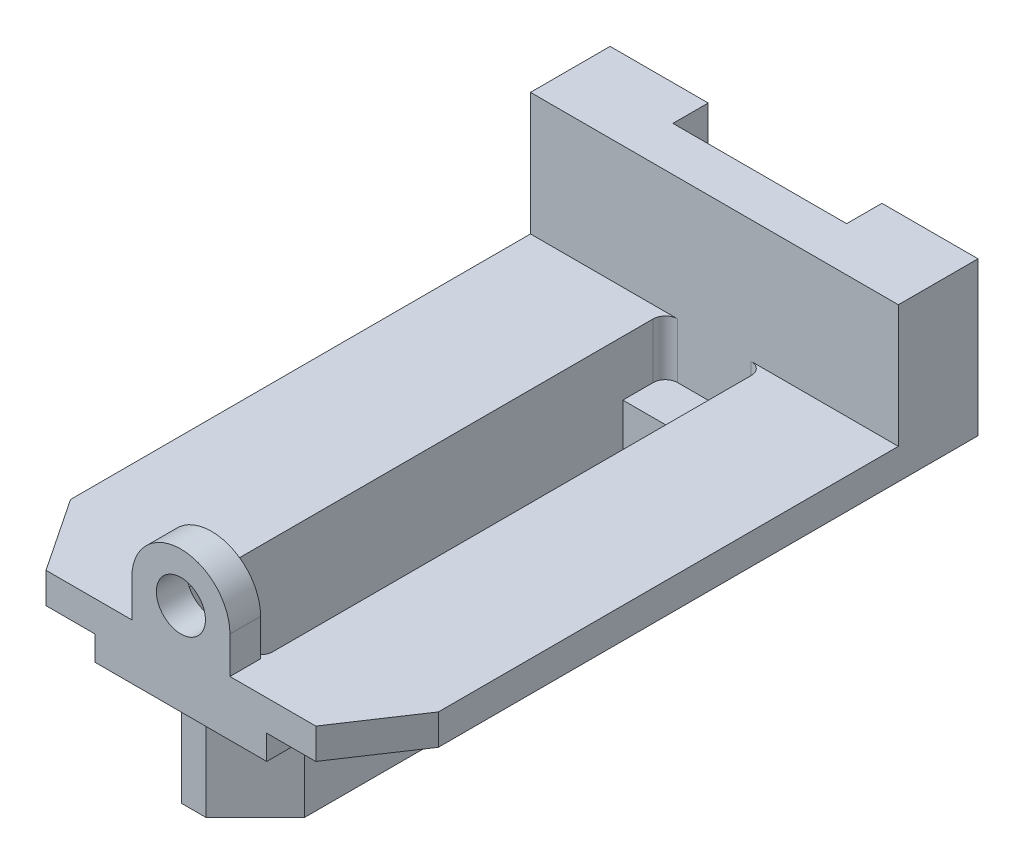
from build123d import *

# Parameters (mm, degrees)
BOSS_EXTRUDE1_DEPTH = 100
SKETCH2_R           = 4
BOSS_EXTRUDE2_DEPTH = 5
CUT_EXTRUDE1_DEPTH  = 111.145358504
BOSS_EXTRUDE3_DEPTH = 20
SKETCH6_W           = 16
SKETCH6_H           = 82.013760225
CUT_EXTRUDE2_DEPTH  = 20
FILLET1_R           = 2
SKETCH7_W           = 20
SKETCH7_H           = 90.042878707
SKETCH7_W_2         = 16
SKETCH7_H_2         = 66.692206804
BOSS_EXTRUDE4_DEPTH = 15
CHAMFER1_SIZE       = 8


with BuildPart() as part:
    # Sketch1 → Boss-Extrude1 (new body)
    with BuildSketch(Plane.XY):
        Polygon((28, 4), (44, 4), (44, 9), (-16, 9), (-16, 4), (0, 4), (0, 0), (28, 0), align=None)
    extrude(amount=BOSS_EXTRUDE1_DEPTH)

    # Sketch2 → Boss-Extrude2 (add)
    with BuildSketch(Plane.XY.offset(100)):
        with BuildLine():
            Line((6, 15), (6, 0))
            Line((6, 0), (22, 0))
            Line((22, 0), (22, 15))
            ThreePointArc((22, 15), (14, 23), (6, 15))
        make_face()
        with Locations((14, 15)):
            Circle(SKETCH2_R, mode=Mode.SUBTRACT)
    extrude(amount=-BOSS_EXTRUDE2_DEPTH)

    # Sketch3 → Cut-Extrude1 (cut, through all)
    with BuildSketch(Plane(origin=(0, 9, 0), x_dir=(1, 0, 0), z_dir=(0, 1, 0))):
        Polygon((36, -100), (44, -88), (44, -100), align=None)
        Polygon((-8, -100), (-16, -100), (-16, -88), align=None)
    extrude(amount=-CUT_EXTRUDE1_DEPTH, mode=Mode.SUBTRACT)

    # Sketch5 → Boss-Extrude3 (add)
    with BuildSketch(Plane(origin=(0, 9, 0), x_dir=(1, 0, 0), z_dir=(0, 1, 0))):
        Polygon((-16, 0), (0, 0), (0, -5.756429966), (28.329099736, -5.756429966), (28.329099736, 0), (44, 0), (44, -12.986239775), (-16, -12.986239775), align=None)
    extrude(amount=BOSS_EXTRUDE3_DEPTH)

    # Sketch6 → Cut-Extrude2 (cut)
    with BuildSketch(Plane(origin=(0, 9, 0), x_dir=(1, 0, 0), z_dir=(0, 1, 0))):
        with Locations((14, -53.993119888)):
            Rectangle(SKETCH6_W, SKETCH6_H)
    extrude(amount=-CUT_EXTRUDE2_DEPTH, mode=Mode.SUBTRACT)

    # Fillet1
    fillet1_edges = [part.edges().sort_by_distance(p)[0] for p in [
        (6, 4.5, 12.986239775),
        (22, 4.5, 12.986239775),
        (22, 4.5, 95),
        (6, 4.5, 95),
    ]]
    fillet(fillet1_edges, radius=FILLET1_R)

    # Sketch7 → Boss-Extrude4 (add)
    with BuildSketch(Plane.XZ):
        with Locations((14, 52.847885125)):
            Rectangle(SKETCH7_W, SKETCH7_H)
        with Locations((14, 53.267861238)):
            Rectangle(SKETCH7_W_2, SKETCH7_H_2, mode=Mode.SUBTRACT)
    extrude(amount=BOSS_EXTRUDE4_DEPTH)

    # Chamfer1
    chamfer1_edges = [part.edges().sort_by_distance(p)[0] for p in [
        (4, -7.5, 97.869324478),
        (4, -7.5, 7.826445771),
        (24, -7.5, 7.826445771),
        (24, -7.5, 97.869324478),
    ]]
    chamfer(chamfer1_edges, length=CHAMFER1_SIZE)


solid = part.part
